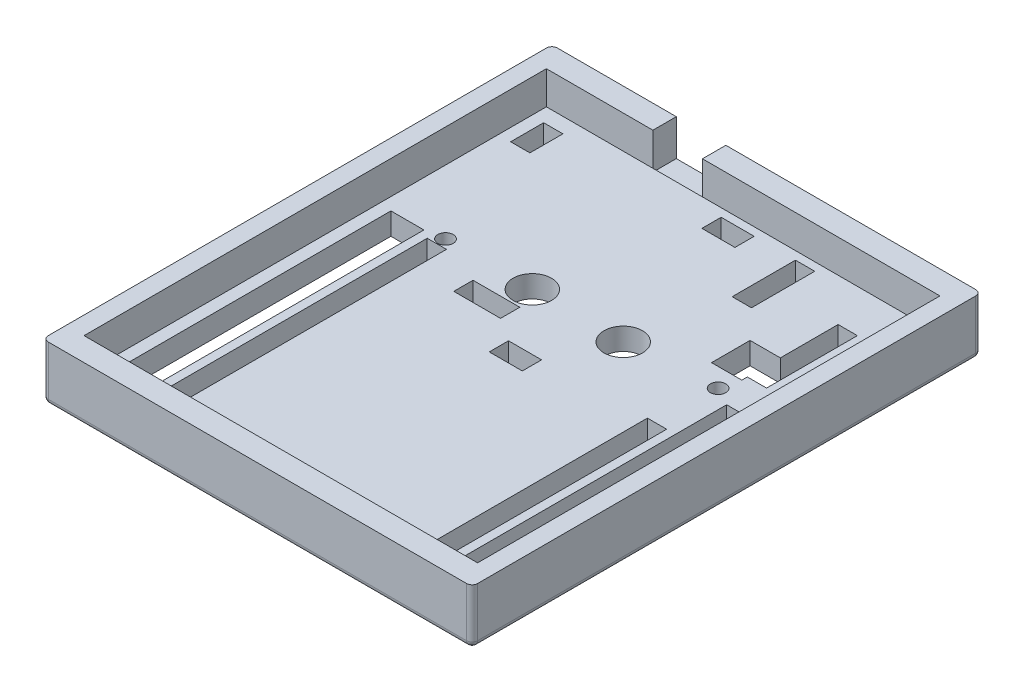
from build123d import *

# Parameters (mm, degrees)
SKETCH1_W            = 78
SKETCH1_H            = 92.5
SKETCH1_R            = 1.4
SKETCH1_R_2          = 3.5
SKETCH1_W_2          = 6
SKETCH1_H_2          = 50
SKETCH1_W_3          = 3.5
SKETCH1_H_3          = 6
SKETCH1_H_4          = 49.3
SKETCH1_H_5          = 41
SKETCH1_H_6          = 11.5
SKETCH1_H_7          = 3.5
SKETCH1_W_4          = 8.5
BASE_DEPTH           = 10
SKETCH2_W            = 71.5
SKETCH2_H            = 84
PCB_CUTOUT_DEPTH     = 6
SKETCH3_W            = 9
SKETCH3_H            = 6.6
USB_SLOT_DEPTH       = 4.25
F_1MM_EDGE_FILLETS_R = 1


with BuildPart() as part:
    # Sketch1 → Base (new body)
    with BuildSketch(Plane(origin=(0, 0, 0), x_dir=(1, 0, 0), z_dir=(0, 1, 0))):
        Rectangle(SKETCH1_W, SKETCH1_H)
        with Locations(Location((-24.13, 12.05, 0), (0, 0, 270))):
            Circle(SKETCH1_R, mode=Mode.SUBTRACT)
        with Locations(Location((24.13, 13.32, 0), (0, 0, 270))):
            Circle(SKETCH1_R, mode=Mode.SUBTRACT)
        with Locations(Location((-8.89, -38.75, 0), (0, 0, 270))):
            Circle(SKETCH1_R, mode=Mode.SUBTRACT)
        with Locations(Location((8.2055, 12.0071, 0), (0, 0, 270))):
            Circle(SKETCH1_R_2, mode=Mode.SUBTRACT)
        with Locations(Location((-8.3159, 12.0071, 0), (0, 0, 270))):
            Circle(SKETCH1_R_2, mode=Mode.SUBTRACT)
        with Locations((-30.5, -13.5)):
            Rectangle(SKETCH1_W_2, SKETCH1_H_2, mode=Mode.SUBTRACT)
        with Locations((30.5, -13.5)):
            Rectangle(SKETCH1_W_2, SKETCH1_H_2, mode=Mode.SUBTRACT)
        with Locations((31.75, 36.25)):
            Rectangle(SKETCH1_W_3, SKETCH1_H_3, mode=Mode.SUBTRACT)
        with Locations((-31.75, 36.25)):
            Rectangle(SKETCH1_W_3, SKETCH1_H_3, mode=Mode.SUBTRACT)
        Polygon((25, 34.25), (25, 23.75), (19.5, 23.75), (19.5, 16.75), (25, 16.75), (25, 17.75), (28.5, 17.75), (28.5, 34.25), align=None, mode=Mode.SUBTRACT)
        with Locations((-24.15, -14.15)):
            Rectangle(SKETCH1_W_3, SKETCH1_H_4, mode=Mode.SUBTRACT)
        with Locations((24.15, -18.3)):
            Rectangle(SKETCH1_W_3, SKETCH1_H_5, mode=Mode.SUBTRACT)
        with Locations((12.75, 34.75)):
            Rectangle(SKETCH1_W_3, SKETCH1_H_6, mode=Mode.SUBTRACT)
        with Locations((0.5, 38.75)):
            Rectangle(SKETCH1_W_2, SKETCH1_H_7, mode=Mode.SUBTRACT)
        with Locations((-10.88, 6.3)):
            Rectangle(SKETCH1_W_4, SKETCH1_H_7, mode=Mode.SUBTRACT)
        with Locations((0.62, 0)):
            Rectangle(SKETCH1_W_2, SKETCH1_H_7, mode=Mode.SUBTRACT)
    extrude(amount=BASE_DEPTH)

    # Sketch2 → PCB Cutout (cut)
    with BuildSketch(Plane.XZ.offset(-10)):
        Rectangle(SKETCH2_W, SKETCH2_H)
    extrude(amount=PCB_CUTOUT_DEPTH, mode=Mode.SUBTRACT)

    # Sketch3 → USB Slot (cut)
    with BuildSketch(Plane(origin=(0, 0, -46.25), x_dir=(-1, 0, 0), z_dir=(0, 0, -1))):
        with Locations((11.9, 6.7)):
            Rectangle(SKETCH3_W, SKETCH3_H)
    extrude(amount=-USB_SLOT_DEPTH, mode=Mode.SUBTRACT)

    # 1mm Edge Fillets
    f_1mm_edge_fillets_edges = [part.edges().sort_by_distance(p)[0] for p in [
        (0, 0, -46.25),
        (39, 0, 0),
        (0, 0, 46.25),
        (-39, 0, 0),
        (-39, 5, -46.25),
        (39, 5, -46.25),
        (39, 5, 46.25),
        (-39, 5, 46.25),
    ]]
    fillet(f_1mm_edge_fillets_edges, radius=F_1MM_EDGE_FILLETS_R)


solid = part.part
